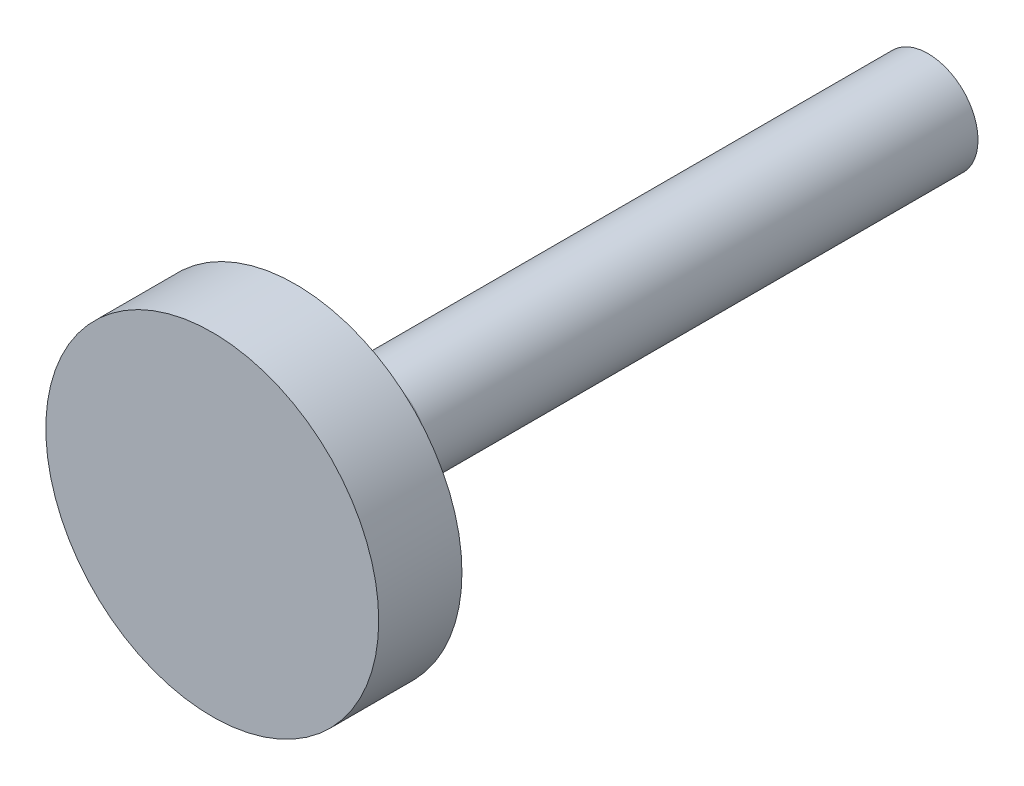
from build123d import *

# Parameters (mm, degrees)
SKETCH1_R           = 3
BOSS_EXTRUDE1_DEPTH = 38
SKETCH2_R           = 10
BOSS_EXTRUDE2_DEPTH = 5
FILLET1_R           = 5


with BuildPart() as part:
    # Sketch1 → Boss-Extrude1 (new body)
    with BuildSketch(Plane.XY):
        Circle(SKETCH1_R)
    extrude(amount=BOSS_EXTRUDE1_DEPTH)

    # Sketch2 → Boss-Extrude2 (add)
    with BuildSketch(Plane.XY.offset(38)):
        Circle(SKETCH2_R)
    extrude(amount=BOSS_EXTRUDE2_DEPTH)

    # Fillet1
    fillet1_edges = [part.edges().sort_by_distance(p)[0] for p in [
        (-3, 0, 38),
    ]]
    fillet(fillet1_edges, radius=FILLET1_R)


solid = part.part
